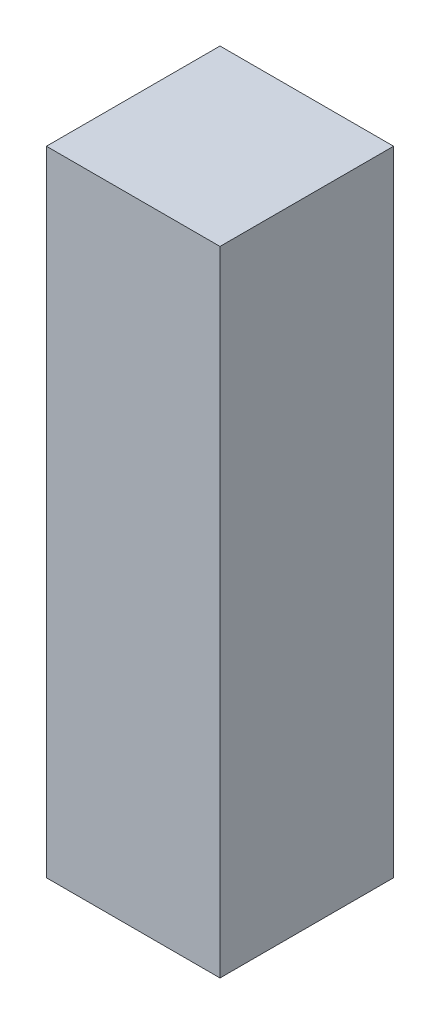
from build123d import *

# Parameters (mm, degrees)
SKETCH_1_W      = 20
SKETCH_1_H      = 20
EXTRUDE_1_DEPTH = 73


with BuildPart() as part:
    # 草图1 → 凸台-拉伸1 (new body)
    with BuildSketch(Plane(origin=(0, 0, 0), x_dir=(1, 0, 0), z_dir=(0, 1, 0))):
        Rectangle(SKETCH_1_W, SKETCH_1_H)
    extrude(amount=EXTRUDE_1_DEPTH)


solid = part.part
